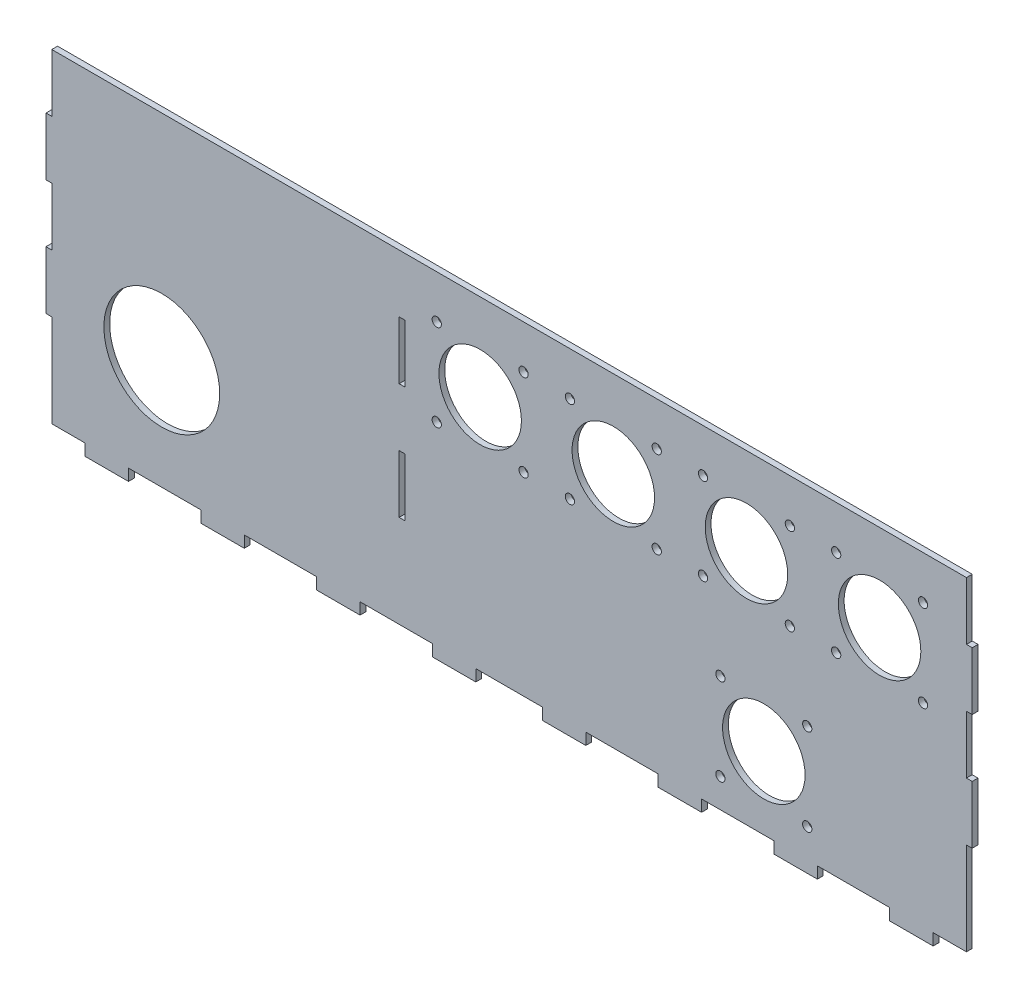
from build123d import *

# Parameters (mm, degrees)
SKETCH1_R               = 20
SKETCH1_R_2             = 14.25
SKETCH1_R_3             = 1.6
SKETCH1_W               = 2
SKETCH1_H               = 20
BOSS_EXTRUDE1_DEPTH     = 2
CUT_EXTRUDE3_DEPTH      = 171.89177862
CUT_EXTRUDE3_DEPTH_BACK = 171.89177862
SKETCH4_W               = 15
SKETCH4_H               = 2
CUT_EXTRUDE4_DEPTH      = 171.89177862
CUT_EXTRUDE4_DEPTH_BACK = 171.89177862
SKETCH5_R               = 14.25
SKETCH5_R_2             = 1.6


with BuildPart() as part:
    # Sketch1 → Boss-Extrude1 (new body)
    with BuildSketch(Plane.XY):
        Polygon((-158, -56), (-146.5, -56), (-146.5, -60), (-131.5, -60), (-131.5, -56), (-106.5, -56), (-106.5, -60), (-91.5, -60), (-91.5, -56), (-66.5, -56), (-66.5, -60), (-51.5, -60), (-51.5, -56), (-26.5, -56), (-26.5, -60), (-11.5, -60), (-11.5, -56), (11.5, -56), (11.5, -60), (26.5, -60), (26.5, -56), (51.5, -56), (51.5, -60), (66.5, -60), (66.5, -56), (91.5, -56), (91.5, -60), (106.5, -60), (106.5, -56), (131.5, -56), (131.5, -60), (146.5, -60), (146.5, -56), (158, -56), (158, -24), (160, -24), (160, -4), (158, -4), (158, 16), (160, 16), (160, 36), (158, 36), (158, 56), (146.5, 56), (146.5, 58), (131.5, 58), (131.5, 56), (106.5, 56), (106.5, 58), (91.5, 58), (91.5, 56), (66.5, 56), (66.5, 58), (51.5, 58), (51.5, 56), (26.5, 56), (26.5, 58), (11.5, 58), (11.5, 56), (-11.5, 56), (-11.5, 58), (-26.5, 58), (-26.5, 56), (-51.5, 56), (-51.5, 58), (-66.5, 58), (-66.5, 56), (-91.5, 56), (-91.5, 58), (-106.5, 58), (-106.5, 56), (-131.5, 56), (-131.5, 58), (-146.5, 58), (-146.5, 56), (-158, 56), (-158, 36), (-160, 36), (-160, 16), (-158, 16), (-158, -4), (-160, -4), (-160, -24), (-158, -24), align=None)
        with Locations((-120, -18)):
            Circle(SKETCH1_R, mode=Mode.SUBTRACT)
        with Locations((88, -31)):
            Circle(SKETCH1_R_2, mode=Mode.SUBTRACT)
        with Locations((73, -16)):
            Circle(SKETCH1_R_3, mode=Mode.SUBTRACT)
        with Locations((103, -16)):
            Circle(SKETCH1_R_3, mode=Mode.SUBTRACT)
        with Locations((73, -46)):
            Circle(SKETCH1_R_3, mode=Mode.SUBTRACT)
        with Locations((103, -46)):
            Circle(SKETCH1_R_3, mode=Mode.SUBTRACT)
        with Locations((-37, -14)):
            Rectangle(SKETCH1_W, SKETCH1_H, mode=Mode.SUBTRACT)
        with Locations((-37, 26)):
            Rectangle(SKETCH1_W, SKETCH1_H, mode=Mode.SUBTRACT)
    extrude(amount=BOSS_EXTRUDE1_DEPTH)

    # Sketch4 → Cut-Extrude3 (cut, two sides: drawn at the far end of the back side and taken through both)
    with BuildSketch(Plane.XY.offset(2).offset(-CUT_EXTRUDE3_DEPTH_BACK)):
        with Locations((-139, 57)):
            Rectangle(SKETCH4_W, SKETCH4_H)
        with Locations((-99, 57)):
            Rectangle(SKETCH4_W, SKETCH4_H)
        with Locations((-59, 57)):
            Rectangle(SKETCH4_W, SKETCH4_H)
        with Locations((-19, 57)):
            Rectangle(SKETCH4_W, SKETCH4_H)
        with Locations((19, 57)):
            Rectangle(SKETCH4_W, SKETCH4_H)
        with Locations((59, 57)):
            Rectangle(SKETCH4_W, SKETCH4_H)
        with Locations((99, 57)):
            Rectangle(SKETCH4_W, SKETCH4_H)
        with Locations((139, 57)):
            Rectangle(SKETCH4_W, SKETCH4_H)
    extrude(amount=CUT_EXTRUDE3_DEPTH + CUT_EXTRUDE3_DEPTH_BACK, mode=Mode.SUBTRACT)

    # Sketch5 → Cut-Extrude4 (cut, two sides: drawn at the far end of the back side and taken through both)
    with BuildSketch(Plane.XY.offset(2).offset(-CUT_EXTRUDE4_DEPTH_BACK)):
        with Locations((128, 26)):
            Circle(SKETCH5_R)
        with Locations((113, 41)):
            Circle(SKETCH5_R_2)
        with Locations((143, 41)):
            Circle(SKETCH5_R_2)
        with Locations((143, 11)):
            Circle(SKETCH5_R_2)
        with Locations((113, 11)):
            Circle(SKETCH5_R_2)
        with Locations((82, 26)):
            Circle(SKETCH5_R)
        with Locations((97, 11)):
            Circle(SKETCH5_R_2)
        with Locations((67, 11)):
            Circle(SKETCH5_R_2)
        with Locations((67, 41)):
            Circle(SKETCH5_R_2)
        with Locations((97, 41)):
            Circle(SKETCH5_R_2)
        with Locations((36, 26)):
            Circle(SKETCH5_R)
        with Locations((51, 11)):
            Circle(SKETCH5_R_2)
        with Locations((21, 11)):
            Circle(SKETCH5_R_2)
        with Locations((21, 41)):
            Circle(SKETCH5_R_2)
        with Locations((51, 41)):
            Circle(SKETCH5_R_2)
        with Locations((-10, 26)):
            Circle(SKETCH5_R)
        with Locations((5, 11)):
            Circle(SKETCH5_R_2)
        with Locations((-25, 11)):
            Circle(SKETCH5_R_2)
        with Locations((-25, 41)):
            Circle(SKETCH5_R_2)
        with Locations((5, 41)):
            Circle(SKETCH5_R_2)
    extrude(amount=CUT_EXTRUDE4_DEPTH + CUT_EXTRUDE4_DEPTH_BACK, mode=Mode.SUBTRACT)


solid = part.part
